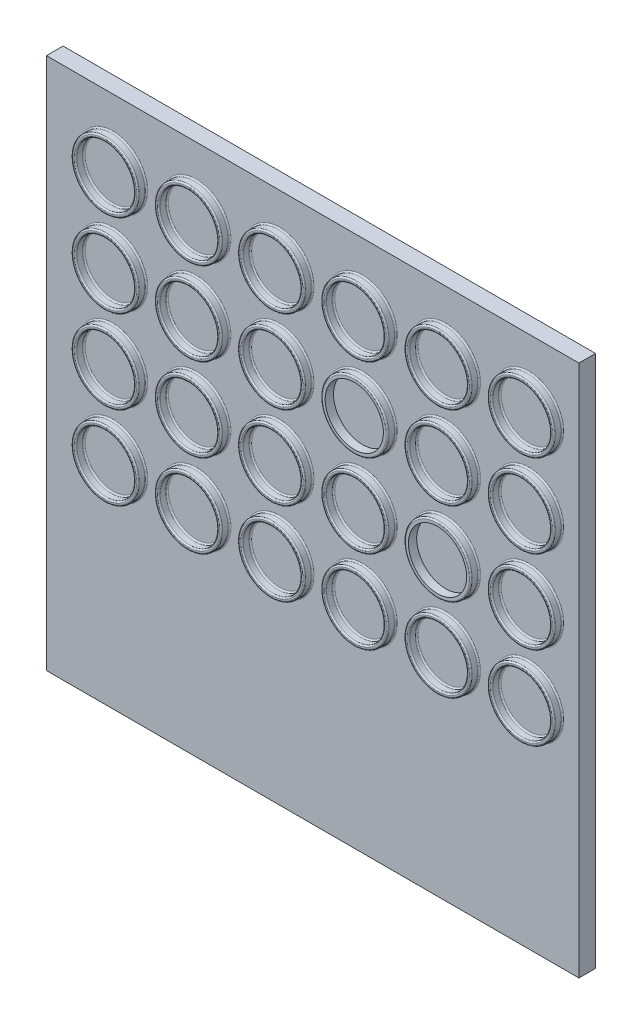
from build123d import *

# Parameters (mm, degrees)
SKETCH1_W           = 203.2
SKETCH1_H           = 203.2
BOSS_EXTRUDE1_DEPTH = 6.35
SKETCH2_R           = 12.7
SKETCH2_R_2         = 11.1125
BOSS_EXTRUDE2_DEPTH = 3.175
SKETCH3_R           = 11.1125
CUT_EXTRUDE1_DEPTH  = 3.175
FILLET2_R           = 0.53975
FILLET3_R           = 0.53975


with BuildPart() as part:
    # Sketch1 → Boss-Extrude1 (new body)
    with BuildSketch(Plane.XY):
        Rectangle(SKETCH1_W, SKETCH1_H)
    extrude(amount=BOSS_EXTRUDE1_DEPTH)

    # Sketch2 → Boss-Extrude2 (add)
    # profile 1 of 24: a face of its own
    with BuildSketch(Plane.XY.offset(6.35)):
        with Locations(Location((-76.2, 76.2, 0), (0, 0, 180))):
            Circle(SKETCH2_R)
        with Locations((-76.2, 76.2)):
            Circle(SKETCH2_R_2, mode=Mode.SUBTRACT)
    # profile 2 of 24: a face of its own
    with BuildSketch(Plane.XY.offset(6.35)):
        with Locations(Location((-44.45, 76.2, 0), (0, 0, 180))):
            Circle(SKETCH2_R)
        with Locations((-44.45, 76.2)):
            Circle(SKETCH2_R_2, mode=Mode.SUBTRACT)
    # profile 3 of 24: a face of its own
    with BuildSketch(Plane.XY.offset(6.35)):
        with Locations(Location((-12.7, 76.2, 0), (0, 0, 180))):
            Circle(SKETCH2_R)
        with Locations((-12.7, 76.2)):
            Circle(SKETCH2_R_2, mode=Mode.SUBTRACT)
    # profile 4 of 24: a face of its own
    with BuildSketch(Plane.XY.offset(6.35)):
        with Locations(Location((19.05, 76.2, 0), (0, 0, 180))):
            Circle(SKETCH2_R)
        with Locations((19.05, 76.2)):
            Circle(SKETCH2_R_2, mode=Mode.SUBTRACT)
    # profile 5 of 24: a face of its own
    with BuildSketch(Plane.XY.offset(6.35)):
        with Locations(Location((50.8, 76.2, 0), (0, 0, 180))):
            Circle(SKETCH2_R)
        with Locations((50.8, 76.2)):
            Circle(SKETCH2_R_2, mode=Mode.SUBTRACT)
    # profile 6 of 24: a face of its own
    with BuildSketch(Plane.XY.offset(6.35)):
        with Locations(Location((82.55, 76.2, 0), (0, 0, 180))):
            Circle(SKETCH2_R)
        with Locations((82.55, 76.2)):
            Circle(SKETCH2_R_2, mode=Mode.SUBTRACT)
    # profile 7 of 24: a face of its own
    with BuildSketch(Plane.XY.offset(6.35)):
        with Locations(Location((-44.45, 44.45, 0), (0, 0, 180))):
            Circle(SKETCH2_R)
        with Locations((-44.45, 44.45)):
            Circle(SKETCH2_R_2, mode=Mode.SUBTRACT)
    # profile 8 of 24: a face of its own
    with BuildSketch(Plane.XY.offset(6.35)):
        with Locations(Location((-12.7, 44.45, 0), (0, 0, 180))):
            Circle(SKETCH2_R)
        with Locations((-12.7, 44.45)):
            Circle(SKETCH2_R_2, mode=Mode.SUBTRACT)
    # profile 9 of 24: a face of its own
    with BuildSketch(Plane.XY.offset(6.35)):
        with Locations(Location((50.8, 44.45, 0), (0, 0, 180))):
            Circle(SKETCH2_R)
        with Locations((50.8, 44.45)):
            Circle(SKETCH2_R_2, mode=Mode.SUBTRACT)
    # profile 10 of 24: a face of its own
    with BuildSketch(Plane.XY.offset(6.35)):
        with Locations(Location((82.55, 44.45, 0), (0, 0, 180))):
            Circle(SKETCH2_R)
        with Locations((82.55, 44.45)):
            Circle(SKETCH2_R_2, mode=Mode.SUBTRACT)
    # profile 11 of 24: a face of its own
    with BuildSketch(Plane.XY.offset(6.35)):
        with Locations(Location((-76.2, 44.45, 0), (0, 0, 180))):
            Circle(SKETCH2_R)
        with Locations((-76.2, 44.45)):
            Circle(SKETCH2_R_2, mode=Mode.SUBTRACT)
    # profile 12 of 24: a face of its own
    with BuildSketch(Plane.XY.offset(6.35)):
        with Locations(Location((-76.2, 12.7, 0), (0, 0, 180))):
            Circle(SKETCH2_R)
        with Locations((-76.2, 12.7)):
            Circle(SKETCH2_R_2, mode=Mode.SUBTRACT)
    # profile 13 of 24: a face of its own
    with BuildSketch(Plane.XY.offset(6.35)):
        with Locations(Location((-76.2, -19.05, 0), (0, 0, 180))):
            Circle(SKETCH2_R)
        with Locations((-76.2, -19.05)):
            Circle(SKETCH2_R_2, mode=Mode.SUBTRACT)
    # profile 14 of 24: a face of its own
    with BuildSketch(Plane.XY.offset(6.35)):
        with Locations(Location((-44.45, 12.7, 0), (0, 0, 180))):
            Circle(SKETCH2_R)
        with Locations((-44.45, 12.7)):
            Circle(SKETCH2_R_2, mode=Mode.SUBTRACT)
    # profile 15 of 24: a face of its own
    with BuildSketch(Plane.XY.offset(6.35)):
        with Locations(Location((-12.7, 12.7, 0), (0, 0, 180))):
            Circle(SKETCH2_R)
        with Locations((-12.7, 12.7)):
            Circle(SKETCH2_R_2, mode=Mode.SUBTRACT)
    # profile 16 of 24: a face of its own
    with BuildSketch(Plane.XY.offset(6.35)):
        with Locations(Location((19.05, 12.7, 0), (0, 0, 180))):
            Circle(SKETCH2_R)
        with Locations((19.05, 12.7)):
            Circle(SKETCH2_R_2, mode=Mode.SUBTRACT)
    # profile 17 of 24: a face of its own
    with BuildSketch(Plane.XY.offset(6.35)):
        with Locations(Location((50.8, 12.7, 0), (0, 0, 180))):
            Circle(SKETCH2_R)
    # profile 18 of 24: a face of its own
    with BuildSketch(Plane.XY.offset(6.35)):
        with Locations(Location((82.55, 12.7, 0), (0, 0, 180))):
            Circle(SKETCH2_R)
        with Locations((82.55, 12.7)):
            Circle(SKETCH2_R_2, mode=Mode.SUBTRACT)
    # profile 19 of 24: a face of its own
    with BuildSketch(Plane.XY.offset(6.35)):
        with Locations(Location((-44.45, -19.05, 0), (0, 0, 180))):
            Circle(SKETCH2_R)
        with Locations((-44.45, -19.05)):
            Circle(SKETCH2_R_2, mode=Mode.SUBTRACT)
    # profile 20 of 24: a face of its own
    with BuildSketch(Plane.XY.offset(6.35)):
        with Locations(Location((-12.7, -19.05, 0), (0, 0, 180))):
            Circle(SKETCH2_R)
        with Locations((-12.7, -19.05)):
            Circle(SKETCH2_R_2, mode=Mode.SUBTRACT)
    # profile 21 of 24: a face of its own
    with BuildSketch(Plane.XY.offset(6.35)):
        with Locations(Location((19.05, 44.45, 0), (0, 0, 180))):
            Circle(SKETCH2_R)
    # profile 22 of 24: a face of its own
    with BuildSketch(Plane.XY.offset(6.35)):
        with Locations(Location((19.05, -19.05, 0), (0, 0, 180))):
            Circle(SKETCH2_R)
        with Locations((19.05, -19.05)):
            Circle(SKETCH2_R_2, mode=Mode.SUBTRACT)
    # profile 23 of 24: a face of its own
    with BuildSketch(Plane.XY.offset(6.35)):
        with Locations(Location((50.8, -19.05, 0), (0, 0, 180))):
            Circle(SKETCH2_R)
        with Locations((50.8, -19.05)):
            Circle(SKETCH2_R_2, mode=Mode.SUBTRACT)
    # profile 24 of 24: a face of its own
    with BuildSketch(Plane.XY.offset(6.35)):
        with Locations(Location((82.55, -19.05, 0), (0, 0, 180))):
            Circle(SKETCH2_R)
        with Locations((82.55, -19.05)):
            Circle(SKETCH2_R_2, mode=Mode.SUBTRACT)
    extrude(amount=BOSS_EXTRUDE2_DEPTH)

    # Sketch3 → Cut-Extrude1 (cut)
    with BuildSketch(Plane.XY.offset(9.525)):
        with Locations((19.05, 44.45)):
            Circle(SKETCH3_R)
        with Locations((50.8, 12.7)):
            Circle(SKETCH3_R)
    extrude(amount=-CUT_EXTRUDE1_DEPTH, mode=Mode.SUBTRACT)

    # Fillet2
    fillet2_edges = [part.edges().sort_by_distance(p)[0] for p in [
        (71.4375, 44.45, 9.525),
        (95.25, 44.45, 9.525),
        (7.9375, 12.7, 9.525),
        (31.75, 12.7, 9.525),
        (-23.8125, 12.7, 9.525),
        (0, 12.7, 9.525),
        (-55.5625, 12.7, 9.525),
        (-31.75, 12.7, 9.525),
        (-87.3125, 12.7, 9.525),
        (-63.5, 12.7, 9.525),
        (-23.8125, 44.45, 9.525),
        (0, 44.45, 9.525),
        (-55.5625, 44.45, 9.525),
        (-31.75, 44.45, 9.525),
        (-87.3125, 76.2, 9.525),
        (-87.3125, 44.45, 9.525),
        (-63.5, 44.45, 9.525),
        (-63.5, 76.2, 9.525),
        (31.75, 44.45, 9.525),
        (-55.5625, 76.2, 9.525),
        (-31.75, 76.2, 9.525),
        (-23.8125, 76.2, 9.525),
        (0, 76.2, 9.525),
        (7.9375, 76.2, 9.525),
        (31.75, 76.2, 9.525),
        (39.6875, 76.2, 9.525),
        (63.5, 76.2, 9.525),
        (71.4375, 76.2, 9.525),
        (95.25, 76.2, 9.525),
        (39.6875, 44.45, 9.525),
        (63.5, 44.45, 9.525),
        (63.5, 12.7, 9.525),
        (-87.3125, -19.05, 9.525),
        (-63.5, -19.05, 9.525),
        (-55.5625, -19.05, 9.525),
        (-31.75, -19.05, 9.525),
        (-23.8125, -19.05, 9.525),
        (0, -19.05, 9.525),
        (7.9375, -19.05, 9.525),
        (31.75, -19.05, 9.525),
        (39.6875, -19.05, 9.525),
        (63.5, -19.05, 9.525),
        (71.4375, -19.05, 9.525),
        (95.25, -19.05, 9.525),
        (71.4375, 12.7, 9.525),
        (95.25, 12.7, 9.525),
    ]]
    fillet(fillet2_edges, radius=FILLET2_R)

    # Fillet3
    fillet3_edges = [part.edges().sort_by_distance(p)[0] for p in [
        (95.25, 44.45, 6.35),
        (71.4375, 44.45, 6.35),
        (31.75, 12.7, 6.35),
        (7.9375, 12.7, 6.35),
        (0, 12.7, 6.35),
        (-23.8125, 12.7, 6.35),
        (-31.75, 12.7, 6.35),
        (-55.5625, 12.7, 6.35),
        (-63.5, 12.7, 6.35),
        (-87.3125, 12.7, 6.35),
        (-63.5, 76.2, 6.35),
        (0, 44.45, 6.35),
        (-23.8125, 44.45, 6.35),
        (-31.75, 44.45, 6.35),
        (-55.5625, 44.45, 6.35),
        (-63.5, 44.45, 6.35),
        (-87.3125, 44.45, 6.35),
        (31.75, 44.45, 6.35),
        (-87.3125, 76.2, 6.35),
        (-31.75, 76.2, 6.35),
        (-55.5625, 76.2, 6.35),
        (0, 76.2, 6.35),
        (-23.8125, 76.2, 6.35),
        (31.75, 76.2, 6.35),
        (7.9375, 76.2, 6.35),
        (63.5, 76.2, 6.35),
        (39.6875, 76.2, 6.35),
        (95.25, 76.2, 6.35),
        (71.4375, 76.2, 6.35),
        (63.5, 44.45, 6.35),
        (39.6875, 44.45, 6.35),
        (63.5, 12.7, 6.35),
        (-63.5, -19.05, 6.35),
        (-87.3125, -19.05, 6.35),
        (-31.75, -19.05, 6.35),
        (-55.5625, -19.05, 6.35),
        (0, -19.05, 6.35),
        (-23.8125, -19.05, 6.35),
        (31.75, -19.05, 6.35),
        (7.9375, -19.05, 6.35),
        (63.5, -19.05, 6.35),
        (39.6875, -19.05, 6.35),
        (95.25, -19.05, 6.35),
        (71.4375, -19.05, 6.35),
        (95.25, 12.7, 6.35),
        (71.4375, 12.7, 6.35),
    ]]
    fillet(fillet3_edges, radius=FILLET3_R)


solid = part.part
